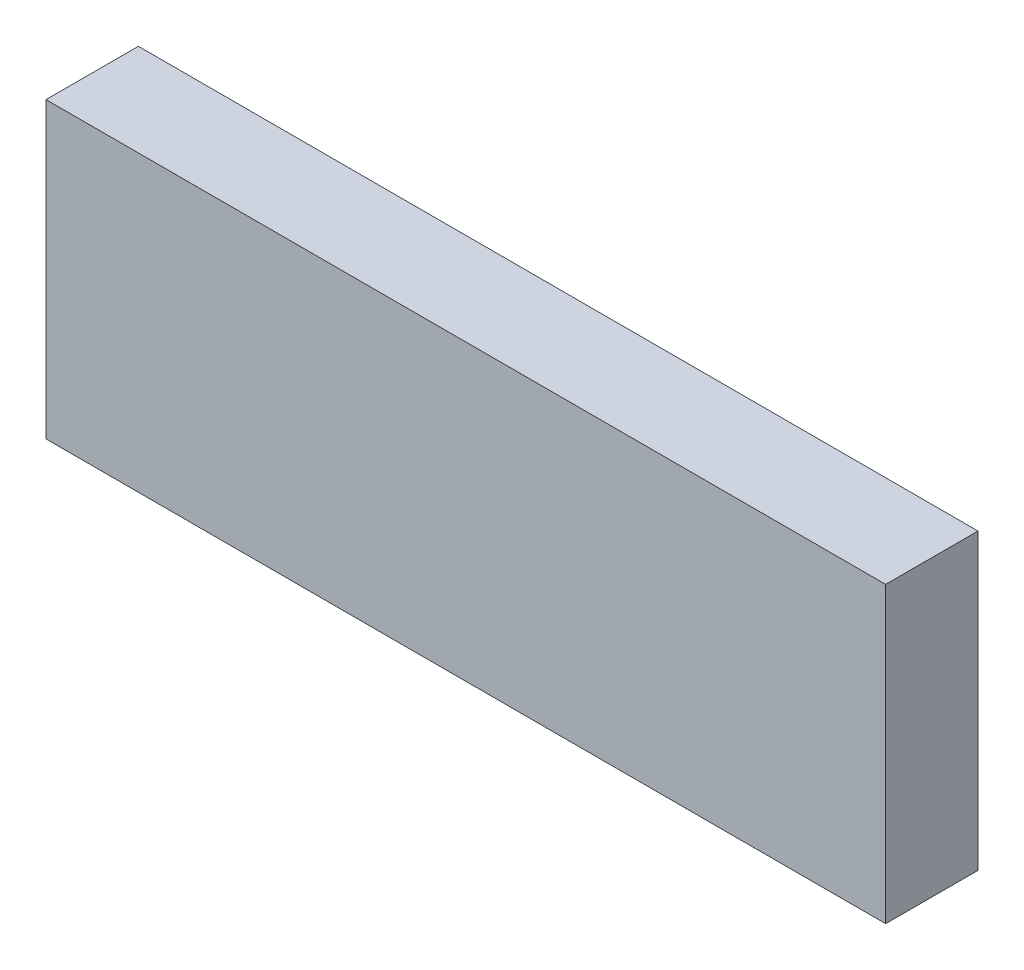
from build123d import *

# Parameters (mm, degrees)
SKETCH1_W           = 200
SKETCH1_H           = 70
BOSS_EXTRUDE1_DEPTH = 22


with BuildPart() as part:
    # Sketch1 → Boss-Extrude1 (new body)
    with BuildSketch(Plane.XY):
        Rectangle(SKETCH1_W, SKETCH1_H)
    extrude(amount=BOSS_EXTRUDE1_DEPTH)


solid = part.part
